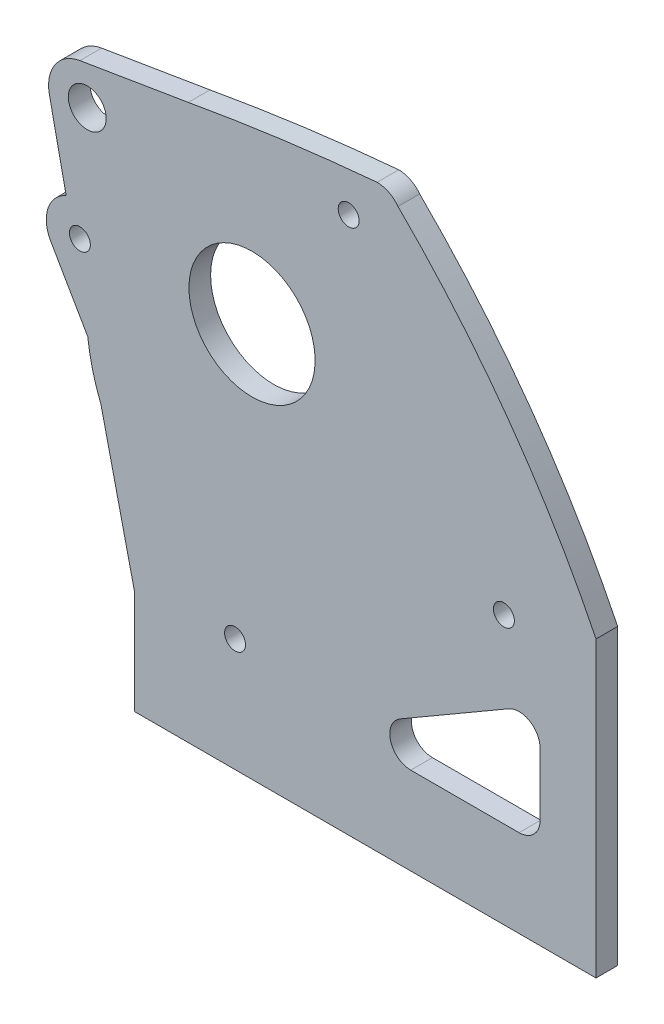
from build123d import *

# Parameters (mm, degrees)
SKETCH1_R           = 5.42927296
SKETCH1_R_2         = 18.05
SKETCH1_R_3         = 3
BOSS_EXTRUDE1_DEPTH = 6.2


with BuildPart() as part:
    # Sketch1 → Boss-Extrude1 (new body)
    with BuildSketch(Plane.XY):
        with BuildLine():
            ThreePointArc((22.30856743, 80.228990984), (19.658905911, 82.429667946), (16.30856743, 83.228990984))
            ThreePointArc((16.30856743, 83.228990984), (-10.777239886, 80.224067192), (-37.702247141, 76.015206396))
            Line((-37.702247141, 76.015206396), (-37.971821537, 75.970473087))
            Line((-37.971821537, 75.970473087), (-68.682554074, 70.874318891))
            ThreePointArc((-68.682554074, 70.874318891), (-75.78826802, 66.335898634), (-77.417928756, 58.063496625))
            Line((-77.417928756, 58.063496625), (-72.629383419, 35.535152501))
            Line((-72.629383419, 35.535152501), (-73.507041371, 35.028436446))
            ThreePointArc((-73.507041371, 35.028436446), (-77.979929304, 29.199255403), (-77.020885248, 21.91459257))
            Line((-77.020885248, 21.91459257), (-66.455316905, 3.61449139))
            ThreePointArc((-66.455316905, 3.61449139), (-65.048189041, -4.003273118), (-62.651846579, -11.369947247))
            Line((-62.651846579, -11.369947247), (-53.06582932, -52.891535091))
            Line((-53.06582932, -52.891535091), (-53.055513447, -82.591545802))
            Line((-53.055513447, -82.591545802), (78.944486553, -82.591545802))
            Line((78.944486553, -82.591545802), (78.944486553, -50.191545802))
            Line((78.944486553, -50.191545802), (78.944486553, 1.408454198))
            ThreePointArc((78.944486553, 1.408454198), (53.936647448, 43.197185389), (22.30856743, 80.228990984))
        make_face()
        with Locations(Location((-66.592661175, 60.23811882, 0), (0, 0, 180))):
            Circle(SKETCH1_R, mode=Mode.SUBTRACT)
        with Locations(Location((-19.455513478, 30.208443842, 0), (0, 0, 180))):
            Circle(SKETCH1_R_2, mode=Mode.SUBTRACT)
        with Locations(Location((8.19601445, 71.114592564, 0), (0, 0, 180))):
            Circle(SKETCH1_R_3, mode=Mode.SUBTRACT)
        with Locations(Location((-24.307041406, -50.188463292, 0), (0, 0, 180))):
            Circle(SKETCH1_R_3, mode=Mode.SUBTRACT)
        with Locations(Location((-68.707041371, 26.71459257, 0), (0, 0, 180))):
            Circle(SKETCH1_R_3, mode=Mode.SUBTRACT)
        with Locations(Location((52.59601445, -5.788463292, 0), (0, 0, 180))):
            Circle(SKETCH1_R_3, mode=Mode.SUBTRACT)
        with BuildLine():
            ThreePointArc((22.931673418, -46.402822526), (20.150851995, -53.151619974), (25.944486522, -57.591556206))
            Line((25.944486522, -57.591556206), (56.944486522, -57.591556206))
            ThreePointArc((56.944486522, -57.591556206), (61.18712721, -55.834196893), (62.944486522, -51.591556206))
            Line((62.944486522, -51.591556206), (62.944486522, -33.591556206))
            ThreePointArc((62.944486522, -33.591556206), (59.938073115, -28.391706274), (53.931673418, -28.402822526))
            Line((53.931673418, -28.402822526), (22.931673418, -46.402822526))
        make_face(mode=Mode.SUBTRACT)
    extrude(amount=BOSS_EXTRUDE1_DEPTH)


solid = part.part
